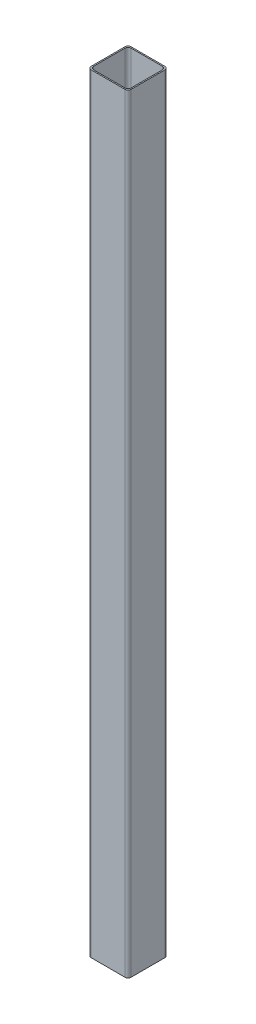
from build123d import *

# Parameters (mm, degrees)
ESBO_O1_W                = 40
ESBO_O1_H                = 40
ESBO_O1_W_2              = 37.6
ESBO_O1_H_2              = 37.6
RESSALTO_EXTRUS_O1_DEPTH = 385
FILETE1_R                = 3


with BuildPart() as part:
    # Esboço1 → Ressalto-extrusão1 (new, symmetric)
    with BuildSketch(Plane(origin=(0, 0, 0), x_dir=(1, 0, 0), z_dir=(0, 1, 0))):
        Rectangle(ESBO_O1_W, ESBO_O1_H)
        Rectangle(ESBO_O1_W_2, ESBO_O1_H_2, mode=Mode.SUBTRACT)
    extrude(amount=RESSALTO_EXTRUS_O1_DEPTH, both=True)

    # Filete1
    filete1_edges = [part.edges().sort_by_distance(p)[0] for p in [
        (-18.8, 0, 18.8),
        (18.8, 0, 18.8),
        (18.8, 0, -18.8),
        (-18.8, 0, -18.8),
        (-20, 0, -20),
        (20, 0, -20),
        (20, 0, 20),
        (-20, 0, 20),
    ]]
    fillet(filete1_edges, radius=FILETE1_R)


solid = part.part
